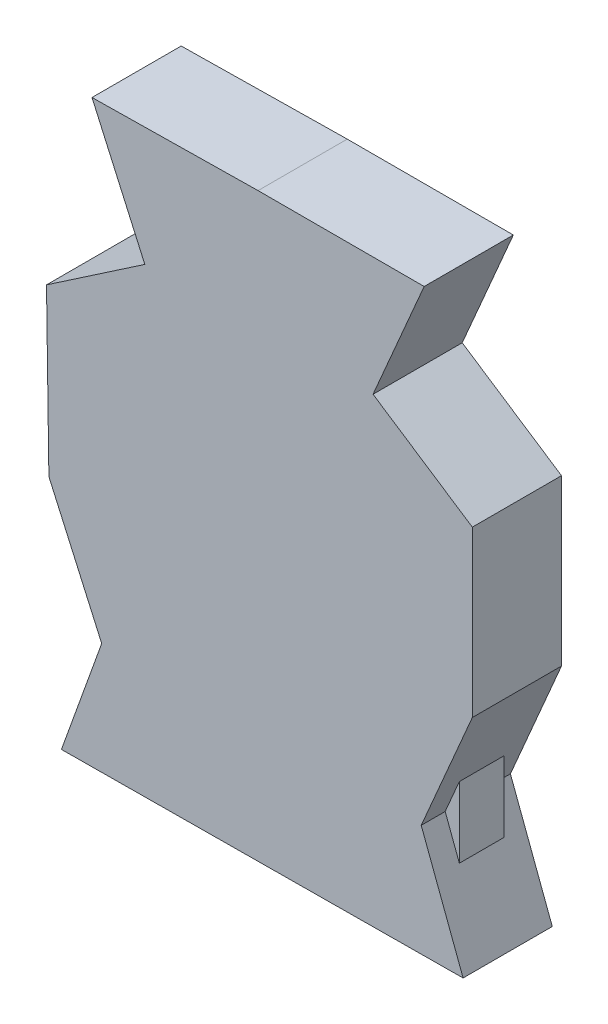
from build123d import *

# Parameters (mm, degrees)
BOSS_EXTRUDE1_DEPTH = 30
SKETCH6_W           = 15
SKETCH6_H           = 30
BOSS_EXTRUDE2_DEPTH = 24


with BuildPart() as part:
    # Sketch2 → Boss-Extrude1 (new body)
    with BuildSketch(Plane.XY):
        Polygon((-35.659220441, 48.994166095), (20.212047263, 48.994166095), (3.020324726, 8.994166095), (36.417587641, -13.019984577), (36.417587641, -68.485610583), (19.225865104, -108.485610583), (33.318130441, -145.920995684), (-101.80917988, -146.898605829), (-88.260031439, -109.263242453), (-106.02870282, -69.516171603), (-106.831218915, -14.056351587), (-73.755968311, 8.438710038), (-91.524639692, 48.185780888), align=None)
    extrude(amount=BOSS_EXTRUDE1_DEPTH)

    # Sketch6 → Boss-Extrude2 (add)
    with BuildSketch(Plane(origin=(0, 0, 0), x_dir=(0, 0, -1), z_dir=(1, 0, 0))):
        with Locations((-14.441506787, -108.571370402)):
            Rectangle(SKETCH6_W, SKETCH6_H)
    extrude(amount=BOSS_EXTRUDE2_DEPTH)


solid = part.part
